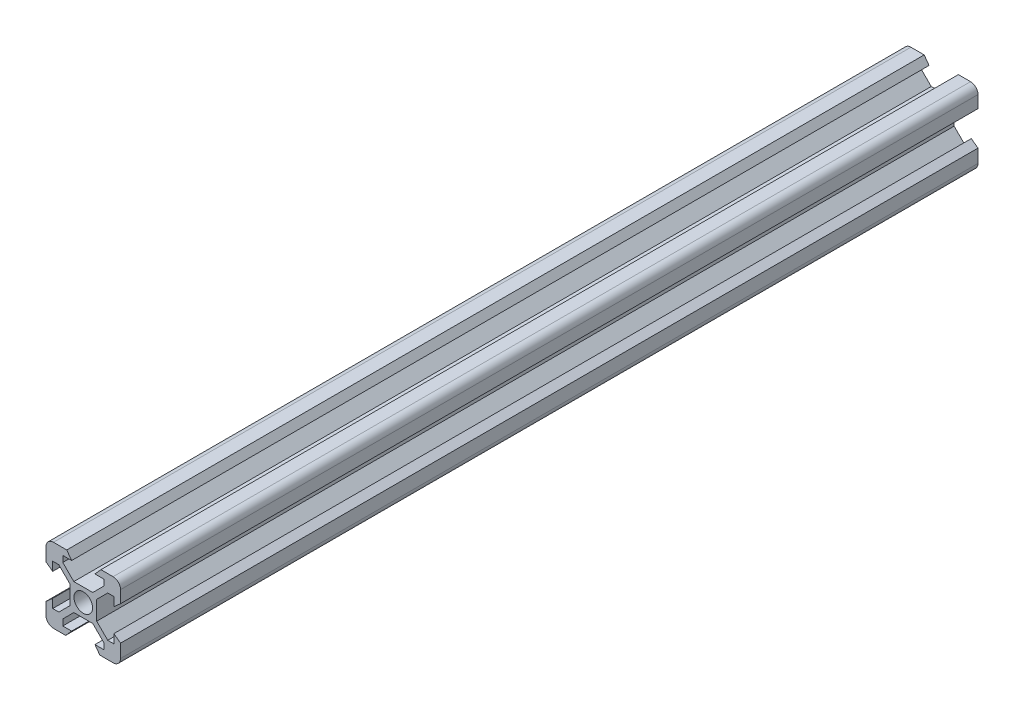
from build123d import *

# Parameters (mm, degrees)
SKETCH1_R           = 2.5
BOSS_EXTRUDE1_DEPTH = 230


with BuildPart() as part:
    # Sketch1 → Boss-Extrude1 (new body)
    with BuildSketch(Plane.XY):
        with BuildLine():
            Line((-4.725542729, -10), (-3.125, -8.2))
            Line((-3.125, -8.2), (-5.5, -8.2))
            Line((-5.5, -8.2), (-5.5, -6.560660172))
            Line((-5.5, -6.560660172), (-2.539339828, -3.6))
            Line((-2.539339828, -3.6), (2.539339828, -3.6))
            Line((2.539339828, -3.6), (5.5, -6.560660172))
            Line((5.5, -6.560660172), (5.5, -8.2))
            Line((5.5, -8.2), (3.125, -8.2))
            Line((3.125, -8.2), (4.434457271, -10))
            Line((4.434457271, -10), (8, -10))
            ThreePointArc((8, -10), (9.414213562, -9.414213562), (10, -8))
            Line((10, -8), (10, -4.434457271))
            Line((10, -4.434457271), (8.2, -3.125))
            Line((8.2, -3.125), (8.2, -5.5))
            Line((8.2, -5.5), (6.560660172, -5.5))
            Line((6.560660172, -5.5), (3.6, -2.539339828))
            Line((3.6, -2.539339828), (3.6, 2.539339828))
            Line((3.6, 2.539339828), (6.560660172, 5.5))
            Line((6.560660172, 5.5), (8.2, 5.5))
            Line((8.2, 5.5), (8.2, 3.125))
            Line((8.2, 3.125), (10, 4.725542729))
            Line((10, 4.725542729), (10, 8))
            ThreePointArc((10, 8), (9.414213562, 9.414213562), (8, 10))
            Line((8, 10), (4.725542729, 10))
            Line((4.725542729, 10), (3.125, 8.2))
            Line((3.125, 8.2), (5.5, 8.2))
            Line((5.5, 8.2), (5.5, 6.560660172))
            Line((5.5, 6.560660172), (2.539339828, 3.6))
            Line((2.539339828, 3.6), (-2.539339828, 3.6))
            Line((-2.539339828, 3.6), (-5.5, 6.560660172))
            Line((-5.5, 6.560660172), (-5.5, 8.2))
            Line((-5.5, 8.2), (-3.125, 8.2))
            Line((-3.125, 8.2), (-4.434457271, 10))
            Line((-4.434457271, 10), (-8, 10))
            ThreePointArc((-8, 10), (-9.414213562, 9.414213562), (-10, 8))
            Line((-10, 8), (-10, 4.434457271))
            Line((-10, 4.434457271), (-8.2, 3.125))
            Line((-8.2, 3.125), (-8.2, 5.5))
            Line((-8.2, 5.5), (-6.560660172, 5.5))
            Line((-6.560660172, 5.5), (-3.6, 2.539339828))
            Line((-3.6, 2.539339828), (-3.6, -2.539339828))
            Line((-3.6, -2.539339828), (-6.560660172, -5.5))
            Line((-6.560660172, -5.5), (-8.2, -5.5))
            Line((-8.2, -5.5), (-8.2, -3.125))
            Line((-8.2, -3.125), (-10, -4.725542729))
            Line((-10, -4.725542729), (-10, -8))
            ThreePointArc((-10, -8), (-9.414213562, -9.414213562), (-8, -10))
            Line((-8, -10), (-4.725542729, -10))
        make_face()
        Circle(SKETCH1_R, mode=Mode.SUBTRACT)
    extrude(amount=BOSS_EXTRUDE1_DEPTH)


solid = part.part
